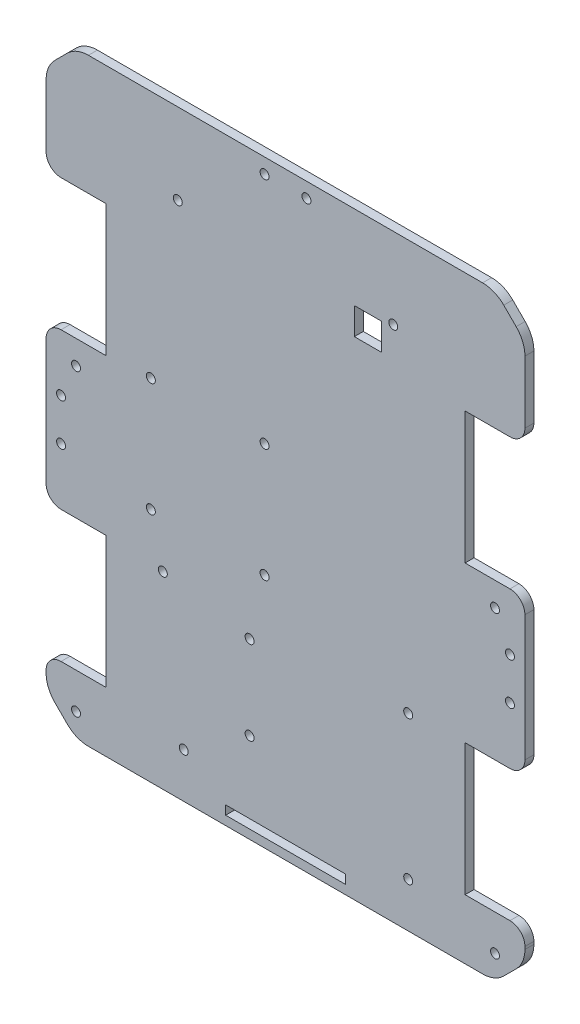
from build123d import *

# Parameters (mm, degrees)
BOSS_EXTRUDE2_DEPTH = 3
SKETCH3_R           = 1.5
SKETCH3_W           = 40
SKETCH3_H           = 3
SKETCH3_W_2         = 9
SKETCH3_H_2         = 9
CUT_EXTRUDE1_DEPTH  = 195.996345243
FILLET1_R           = 10
SKETCH4_R           = 1.5
CUT_EXTRUDE2_DEPTH  = 195.996345243
FILLET2_R           = 5


with BuildPart() as part:
    # Sketch2 → Boss-Extrude2 (new body)
    with BuildSketch(Plane.XY):
        Polygon((-80, 167.804878049), (-80, 137.804878049), (-60, 137.804878049), (-60, 93.804878049), (-80, 93.804878049), (-80, 41.804878049), (-60, 41.804878049), (-60, -2.195121951), (-80, -2.195121951), (-80, -12.195121951), (-70, -22.195121951), (70, -22.195121951), (80, -12.195121951), (80, -2.195121951), (60, -2.195121951), (60, 41.804878049), (80, 41.804878049), (80, 93.804878049), (60, 93.804878049), (60, 137.804878049), (80, 137.804878049), (80, 167.804878049), (70, 177.804878049), (-70, 177.804878049), align=None)
    extrude(amount=BOSS_EXTRUDE2_DEPTH)

    # Sketch3 → Cut-Extrude1 (cut, through all)
    with BuildSketch(Plane.XY.offset(3)):
        with Locations((-75, 74.804878049)):
            Circle(SKETCH3_R)
        with Locations((-75, 60.804878049)):
            Circle(SKETCH3_R)
        with Locations((75, 74.804878049)):
            Circle(SKETCH3_R)
        with Locations((75, 60.804878049)):
            Circle(SKETCH3_R)
        with Locations((-34, -7.195121951)):
            Circle(SKETCH3_R)
        with Locations((41, -7.195121951)):
            Circle(SKETCH3_R)
        with Locations((41, 40.804878049)):
            Circle(SKETCH3_R)
        with Locations((-41, 40.804878049)):
            Circle(SKETCH3_R)
        with Locations((-12, 35.804878049)):
            Circle(SKETCH3_R)
        with Locations((-12, 7.804878049)):
            Circle(SKETCH3_R)
        with Locations((-45, 94.804878049)):
            Circle(SKETCH3_R)
        with Locations((-7, 94.804878049)):
            Circle(SKETCH3_R)
        with Locations((-7, 56.804878049)):
            Circle(SKETCH3_R)
        with Locations((-45, 56.804878049)):
            Circle(SKETCH3_R)
        with Locations((-36, 150.804878049)):
            Circle(SKETCH3_R)
        with Locations((36, 150.804878049)):
            Circle(SKETCH3_R)
        with Locations((-7, 172.804878049)):
            Circle(SKETCH3_R)
        with Locations((7, 172.804878049)):
            Circle(SKETCH3_R)
        with Locations((0, -17.695121951)):
            Rectangle(SKETCH3_W, SKETCH3_H)
        with Locations((27.5, 145.304878049)):
            Rectangle(SKETCH3_W_2, SKETCH3_H_2)
    extrude(amount=-CUT_EXTRUDE1_DEPTH, mode=Mode.SUBTRACT)

    # Fillet1
    fillet1_edges = [part.edges().sort_by_distance(p)[0] for p in [
        (-70, 177.804878049, 1.5),
        (70, 177.804878049, 1.5),
        (80, 167.804878049, 1.5),
        (80, -12.195121951, 1.5),
        (70, -22.195121951, 1.5),
        (-70, -22.195121951, 1.5),
        (-80, -12.195121951, 1.5),
        (-80, 167.804878049, 1.5),
    ]]
    fillet(fillet1_edges, radius=FILLET1_R)

    # Sketch4 → Cut-Extrude2 (cut, through all)
    with BuildSketch(Plane.XY.offset(3)):
        with Locations((-70, 85.804878049)):
            Circle(SKETCH4_R)
        with Locations((70, 85.804878049)):
            Circle(SKETCH4_R)
        with Locations((-70, -14.195121951)):
            Circle(SKETCH4_R)
        with Locations((70, -14.195121951)):
            Circle(SKETCH4_R)
    extrude(amount=-CUT_EXTRUDE2_DEPTH, mode=Mode.SUBTRACT)

    # Fillet2
    fillet2_edges = [part.edges().sort_by_distance(p)[0] for p in [
        (80, 137.804878049, 1.5),
        (80, 93.804878049, 1.5),
        (80, 41.804878049, 1.5),
        (80, -2.195121951, 1.5),
        (-80, -2.195121951, 1.5),
        (-80, 41.804878049, 1.5),
        (-80, 93.804878049, 1.5),
        (-80, 137.804878049, 1.5),
    ]]
    fillet(fillet2_edges, radius=FILLET2_R)


solid = part.part
